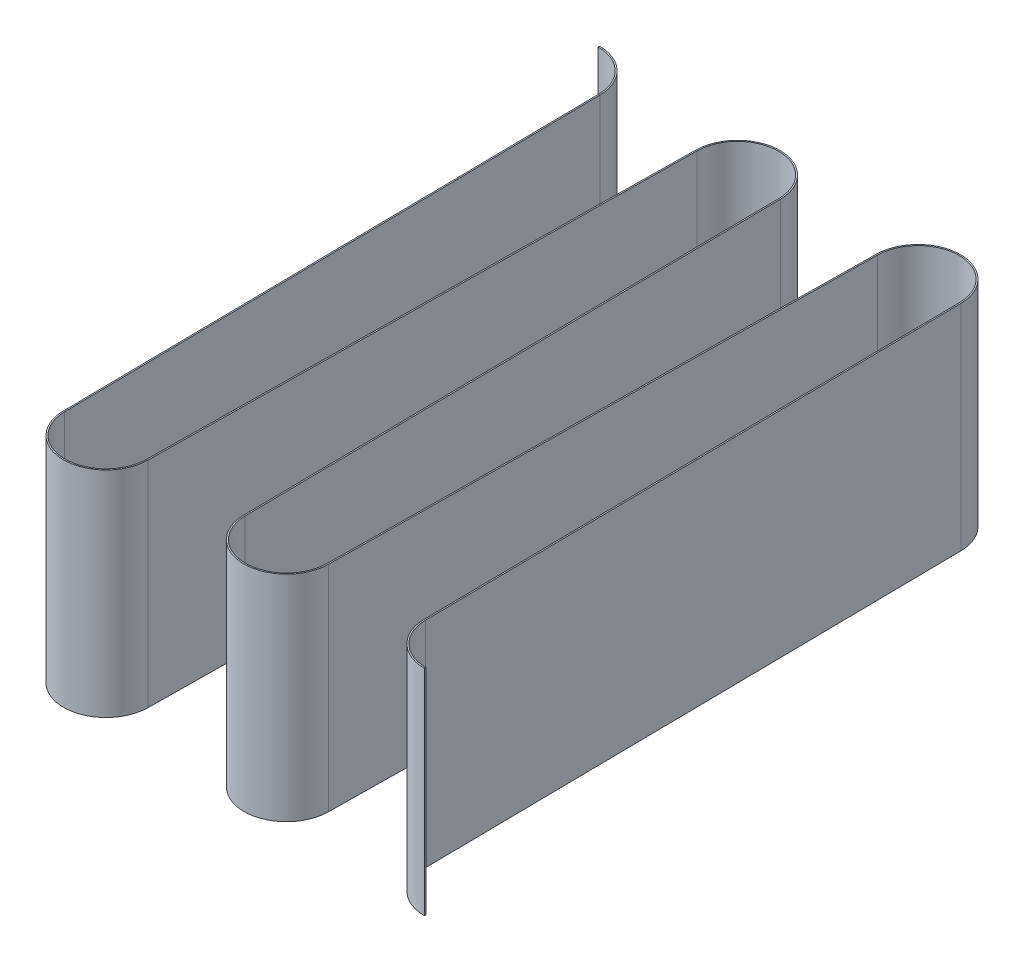
from build123d import *

# Parameters (mm, degrees)
BOSS_EXTRUDE1_DEPTH = 24


with BuildPart() as part:
    # Sketch1 → Boss-Extrude1 (new, symmetric)
    with BuildSketch(Plane(origin=(0, 0, 0), x_dir=(1, 0, 0), z_dir=(0, 1, 0))):
        with BuildLine():
            Line((-41.300703165, 60.713744192), (-39.799273906, -60.717453242))
            ThreePointArc((-39.799273906, -60.717453242), (-30.3, -70.1), (-20.800726094, -60.717453242))
            Line((-20.800726094, -60.717453242), (-19.299296835, 60.713744192))
            ThreePointArc((-19.299296835, 60.713744192), (-10.1, 69.8), (-0.900703165, 60.713744192))
            Line((-0.900703165, 60.713744192), (0.600726094, -60.717453242))
            ThreePointArc((0.600726094, -60.717453242), (10.1, -70.1), (19.599273906, -60.717453242))
            Line((19.599273906, -60.717453242), (21.100703165, 60.713744192))
            ThreePointArc((21.100703165, 60.713744192), (30.3, 69.8), (39.499296835, 60.713744192))
            Line((39.499296835, 60.713744192), (41.000726094, -60.717453242))
            ThreePointArc((41.000726094, -60.717453242), (43.824140722, -67.358912849), (50.5, -70.1))
            Line((50.5, -70.1), (50.5, -69.8))
            ThreePointArc((50.5, -69.8), (44.034957331, -67.145473496), (41.300703165, -60.713744192))
            Line((41.300703165, -60.713744192), (39.799273906, 60.717453242))
            ThreePointArc((39.799273906, 60.717453242), (30.3, 70.1), (20.800726094, 60.717453242))
            Line((20.800726094, 60.717453242), (19.299296835, -60.713744192))
            ThreePointArc((19.299296835, -60.713744192), (10.1, -69.8), (0.900703165, -60.713744192))
            Line((0.900703165, -60.713744192), (-0.600726094, 60.717453242))
            ThreePointArc((-0.600726094, 60.717453242), (-10.1, 70.1), (-19.599273906, 60.717453242))
            Line((-19.599273906, 60.717453242), (-21.100703165, -60.713744192))
            ThreePointArc((-21.100703165, -60.713744192), (-30.3, -69.8), (-39.499296835, -60.713744192))
            Line((-39.499296835, -60.713744192), (-41.000726094, 60.717453242))
            ThreePointArc((-41.000726094, 60.717453242), (-43.824140722, 67.358912849), (-50.5, 70.1))
            Line((-50.5, 70.1), (-50.5, 69.8))
            ThreePointArc((-50.5, 69.8), (-44.034957331, 67.145473496), (-41.300703165, 60.713744192))
        make_face()
    extrude(amount=BOSS_EXTRUDE1_DEPTH, both=True)


solid = part.part
